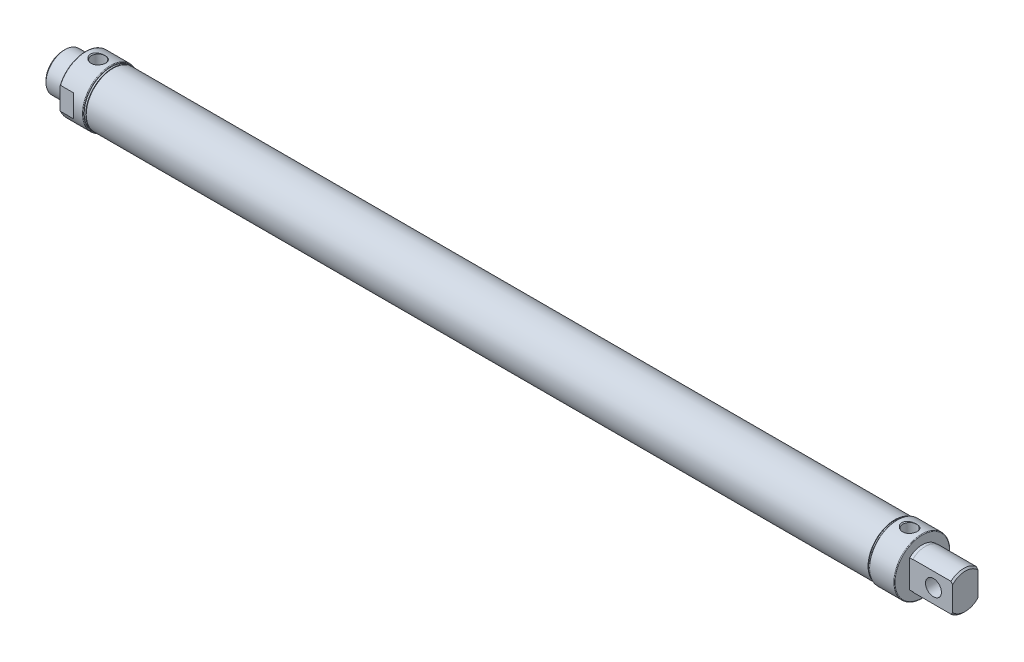
from build123d import *

# Parameters (mm, degrees)
SKETCH_3_W               = 36
SKETCH_3_H               = 44
SKETCH_3_W_2             = 16
SKETCH_3_H_2             = 24
CUT_EXTRUDE_1_DEPTH      = 27
SKETCH_4_W               = 16
SKETCH_4_H               = 5
CUT_EXTRUDE_2_DEPTH      = 35
CUT_EXTRUDE_2_DEPTH_BACK = 35


with BuildPart() as part:
    # 草图1 → 旋转1 (revolve)
    with BuildSketch(Plane.XY):
        with BuildLine():
            Line((0, 0), (0, 10.773))
            Line((0, 10.773), (1.227, 12))
            Line((1.227, 12), (14, 12))
            Line((14, 12), (14, 17.1))
            ThreePointArc((14, 17.1), (14.117157288, 17.382842712), (14.4, 17.5))
            Line((14.4, 17.5), (29.6, 17.5))
            ThreePointArc((29.6, 17.5), (29.882842712, 17.382842712), (30, 17.1))
            Line((30, 17.1), (30, 16.8))
            Line((30, 16.8), (31, 16.8))
            Line((31, 16.8), (31, 16.3))
            Line((31, 16.3), (31.3, 16.8))
            Line((31.3, 16.8), (522.7, 16.8))
            Line((522.7, 16.8), (523, 16.3))
            Line((523, 16.3), (523, 16.8))
            Line((523, 16.8), (524, 16.8))
            Line((524, 16.8), (524, 17.1))
            ThreePointArc((524, 17.1), (524.117157288, 17.382842712), (524.4, 17.5))
            Line((524.4, 17.5), (539.6, 17.5))
            ThreePointArc((539.6, 17.5), (539.882842712, 17.382842712), (540, 17.1))
            Line((540, 17.1), (540, 0))
            Line((540, 0), (0, 0))
        make_face()
    revolve(axis=Axis((540, 0, 0), (-1, 0, 0)))

    # 草图2 → 旋转2 (revolve)
    with BuildSketch(Plane.XY):
        Polygon((540, 0), (540, 11.85), (542, 11.85), (542, 12), (566, 12), (567, 11), (567, 0), align=None)
    revolve(axis=Axis((567, 0, 0), (-1, 0, 0)))

    # 草图3 → 切除-拉伸1 (cut)
    with BuildSketch(Plane(origin=(567, 0, 0), x_dir=(0, 0, -1), z_dir=(1, 0, 0))):
        Rectangle(SKETCH_3_W, SKETCH_3_H)
        Rectangle(SKETCH_3_W_2, SKETCH_3_H_2, mode=Mode.SUBTRACT)
    extrude(amount=-CUT_EXTRUDE_1_DEPTH, mode=Mode.SUBTRACT)

    # 草图4 → 切除-旋转1 (revolve, cut)
    with BuildSketch(Plane(origin=(555, 0, 0), x_dir=(0, 0, -1), z_dir=(1, 0, 0))):
        with Locations((0, 2.5)):
            Rectangle(SKETCH_4_W, SKETCH_4_H)
    revolve(axis=Axis((555, 0, -8), (0, 0, 1)), mode=Mode.SUBTRACT)

    # 草图5 → 切除-旋转2 (revolve, cut)
    with BuildSketch(Plane.XY):
        Polygon((22, 17.5), (26.864, 17.5), (26.283, 16.919), (26.283, 9.5), (22, 9.5), align=None)
    revolve(axis=Axis((22, 9.5, 0), (0, 1, 0)), mode=Mode.SUBTRACT)

    # 草图6 → 切除-旋转3 (revolve, cut)
    with BuildSketch(Plane.XY):
        Polygon((532, 17.5), (536.864, 17.5), (536.283, 16.919), (536.283, 9.5), (532, 9.5), align=None)
    revolve(axis=Axis((532, 9.5, 0), (0, 1, 0)), mode=Mode.SUBTRACT)

    # 草图7 → 切除-拉伸2 (cut, two sides: drawn at the far end of the back side and taken through both)
    with BuildSketch(Plane(origin=(0, 0, 0), x_dir=(1, 0, 0), z_dir=(0, 1, 0)).offset(-CUT_EXTRUDE_2_DEPTH_BACK)):
        Polygon((-4, -17.5), (24, -17.5), (22.5, -16), (-2, -16), (-2, 16), (22.5, 16), (24, 17.5), (-4, 17.5), align=None)
    extrude(amount=CUT_EXTRUDE_2_DEPTH + CUT_EXTRUDE_2_DEPTH_BACK, mode=Mode.SUBTRACT)

    # 草图8 → 切除-旋转4 (revolve, cut)
    with BuildSketch(Plane.XY):
        Polygon((0, 0), (0, 6), (41, 6), (41, 16), (513, 16), (513, 0), align=None)
    revolve(axis=Axis((513, 0, 0), (-1, 0, 0)), mode=Mode.SUBTRACT)


solid = part.part
